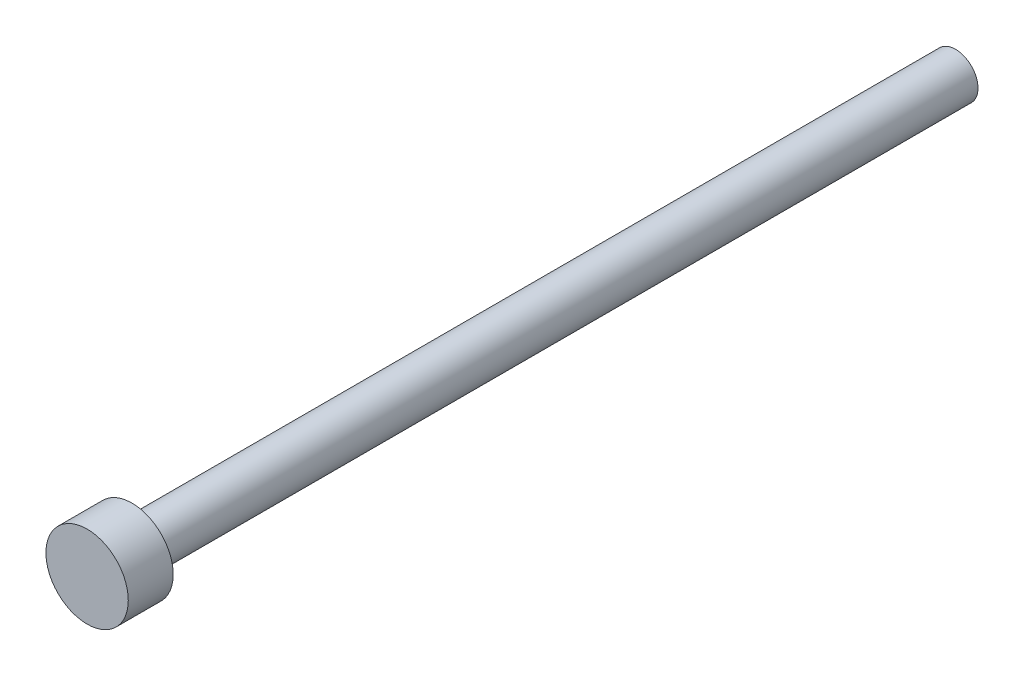
from build123d import *

# Parameters (mm, degrees)
THREAD_ENVELOPE_START = -55
SKETCH1_R             = 1.5
THREAD_ENVELOPE_DEPTH = 55
SKETCH2_R             = 2.75
HEAD_ENVELOPE_DEPTH   = 3


with BuildPart() as part:
    # Sketch1 → Thread_Envelope (new body)
    with BuildSketch(Plane.XY.offset(THREAD_ENVELOPE_START)):
        Circle(SKETCH1_R)
    extrude(amount=THREAD_ENVELOPE_DEPTH)

    # Sketch2 → Head_Envelope (add)
    with BuildSketch(Plane.XY):
        Circle(SKETCH2_R)
    extrude(amount=HEAD_ENVELOPE_DEPTH)


solid = part.part
